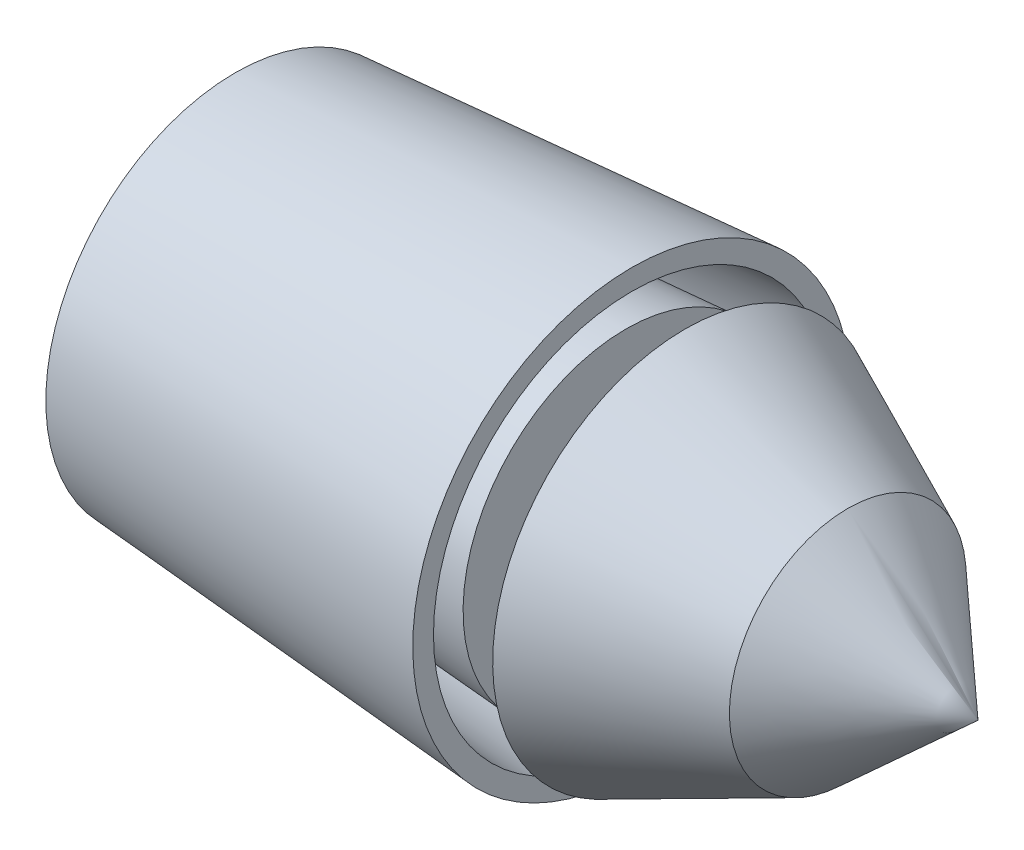
from build123d import *

# Parameters (mm, degrees)
REVOLVE1_ANGLE = 359.999999589
REVOLVE2_ANGLE = 359.999999589
REVOLVE3_ANGLE = 359.999999589


with BuildPart() as part:
    # Sketch1 → Revolve1 (revolve)
    with BuildSketch(Plane.XY):
        Polygon((4800, 250), (4800, 460), (6100, 550), (6100, 250), align=None)
    revolve(axis=Axis((0, 0, 0), (1, 0, 0)), revolution_arc=REVOLVE1_ANGLE)


with BuildPart() as body_2:
    # Sketch2 → Revolve2 (revolve)
    with BuildSketch(Plane.XY):
        Polygon((4780, 580), (4780, 640), (6120, 740), (6120, 670), align=None)
    revolve(axis=Axis((0, 0, 0), (1, 0, 0)), revolution_arc=REVOLVE2_ANGLE)


with BuildPart() as body_3:
    # Sketch3 → Revolve3 (revolve)
    with BuildSketch(Plane.XY):
        Polygon((6300, 350), (6300, 650), (6850, 400), (7290, 0), (6300, 0), align=None)
    revolve(axis=Axis((0, 0, 0), (1, 0, 0)), revolution_arc=REVOLVE3_ANGLE)


solid = Compound([part.part, body_2.part, body_3.part])
